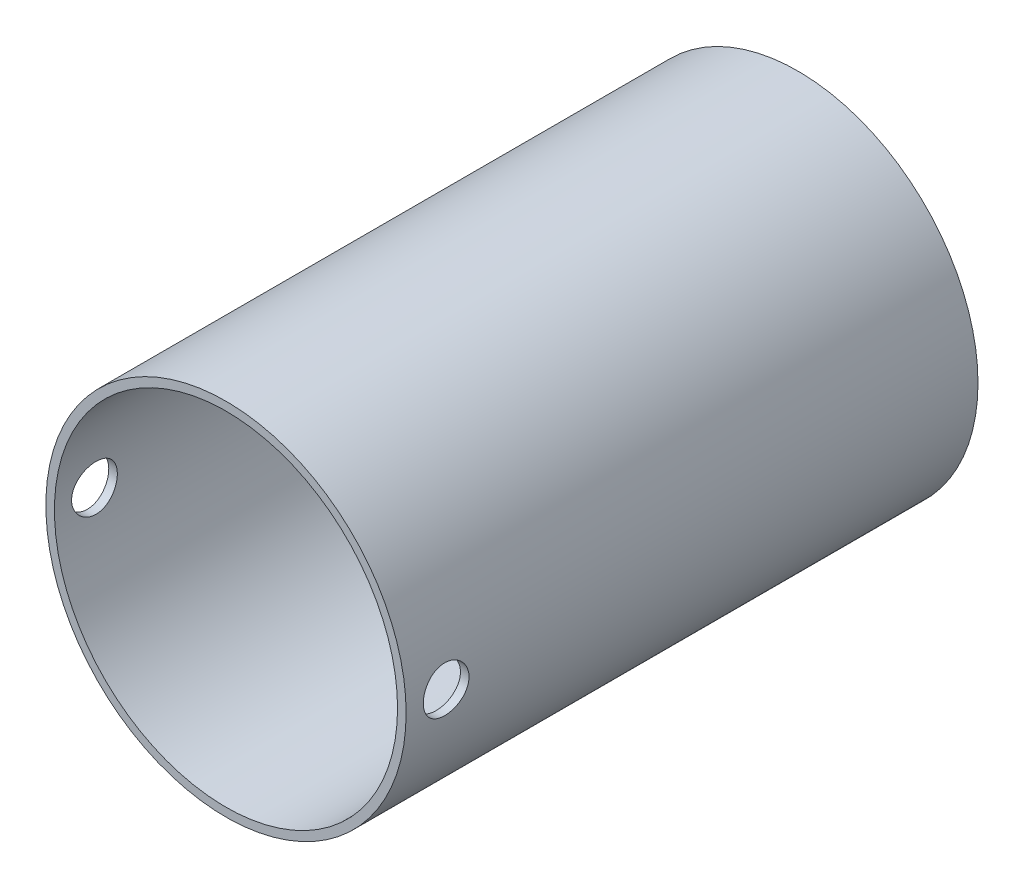
from build123d import *

# Parameters (mm, degrees)
CROQUIS1_R                 = 31.5
CROQUIS1_R_2               = 30
SALIENTE_EXTRUIR1_DEPTH    = 100
CORTAR_EXTRUIR1_DEPTH      = 110.473741144
CORTAR_EXTRUIR1_DEPTH_BACK = 110.473741144
CROQUIS2_R                 = 4


with BuildPart() as part:
    # Croquis1 → Saliente-Extruir1 (new body)
    with BuildSketch(Plane.XY):
        Circle(CROQUIS1_R)
        Circle(CROQUIS1_R_2, mode=Mode.SUBTRACT)
    extrude(amount=SALIENTE_EXTRUIR1_DEPTH)

    # Croquis2 → Cortar-Extruir1 (cut, two sides: drawn at the far end of the back side and taken through both)
    with BuildSketch(Plane(origin=(0, 0, 0), x_dir=(0, 0, -1), z_dir=(1, 0, 0)).offset(-CORTAR_EXTRUIR1_DEPTH_BACK)):
        with Locations((-93, 0)):
            Circle(CROQUIS2_R)
    extrude(amount=CORTAR_EXTRUIR1_DEPTH + CORTAR_EXTRUIR1_DEPTH_BACK, mode=Mode.SUBTRACT)


solid = part.part
